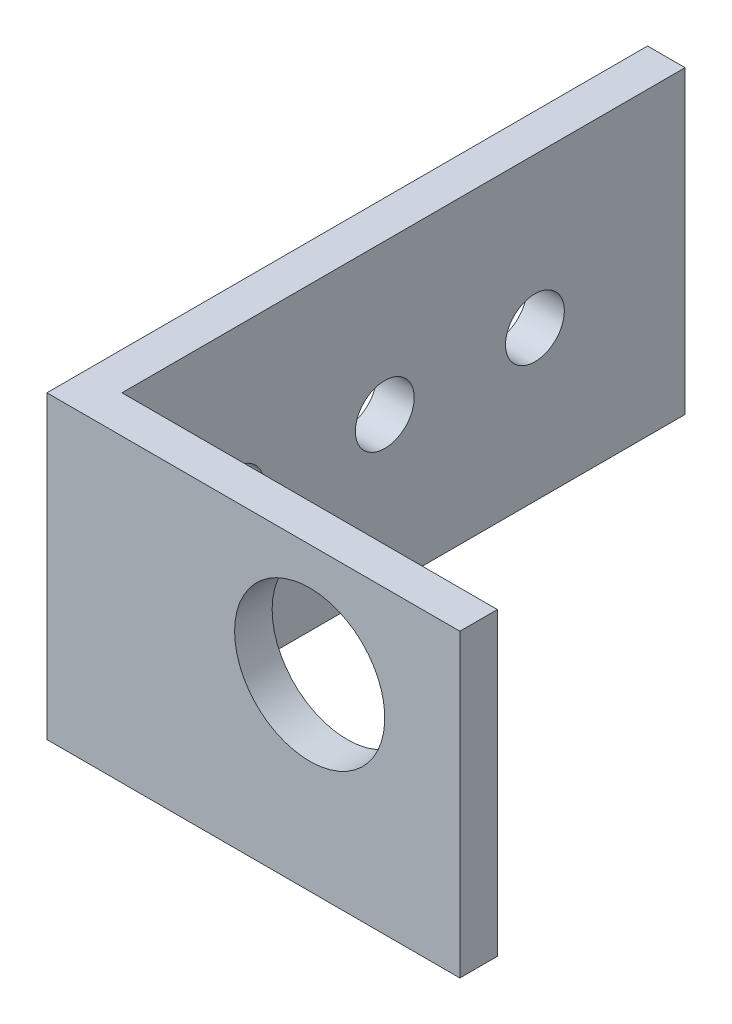
from build123d import *

# Parameters (mm, degrees)
BOSS_EXTRUDE1_DEPTH = 25.4
SKETCH3_R           = 6.35
CUT_EXTRUDE1_DEPTH  = 65.288850122
SKETCH4_R           = 2.4892
CUT_EXTRUDE2_DEPTH  = 66.068137364


with BuildPart() as part:
    # Sketch2 → Boss-Extrude1 (new body)
    with BuildSketch(Plane(origin=(0, 0, 0), x_dir=(1, 0, 0), z_dir=(0, 1, 0))):
        Polygon((0, 0), (0, 50.8), (3.175, 50.8), (3.175, 3.175), (34.925, 3.175), (34.925, 0), align=None)
    extrude(amount=BOSS_EXTRUDE1_DEPTH)

    # Sketch3 → Cut-Extrude1 (cut, through all)
    with BuildSketch(Plane(origin=(0, 0, -3.175), x_dir=(-1, 0, 0), z_dir=(0, 0, -1))):
        with Locations((-22.225, 15.875)):
            Circle(SKETCH3_R)
    extrude(amount=-CUT_EXTRUDE1_DEPTH, mode=Mode.SUBTRACT)

    # Sketch4 → Cut-Extrude2 (cut, through all)
    with BuildSketch(Plane(origin=(3.175, 0, 0), x_dir=(0, 0, -1), z_dir=(1, 0, 0))):
        with Locations((25.4, 12.7)):
            Circle(SKETCH4_R)
        with Locations((12.7, 12.7)):
            Circle(SKETCH4_R)
        with Locations((38.1, 12.7)):
            Circle(SKETCH4_R)
    extrude(amount=-CUT_EXTRUDE2_DEPTH, mode=Mode.SUBTRACT)


solid = part.part
